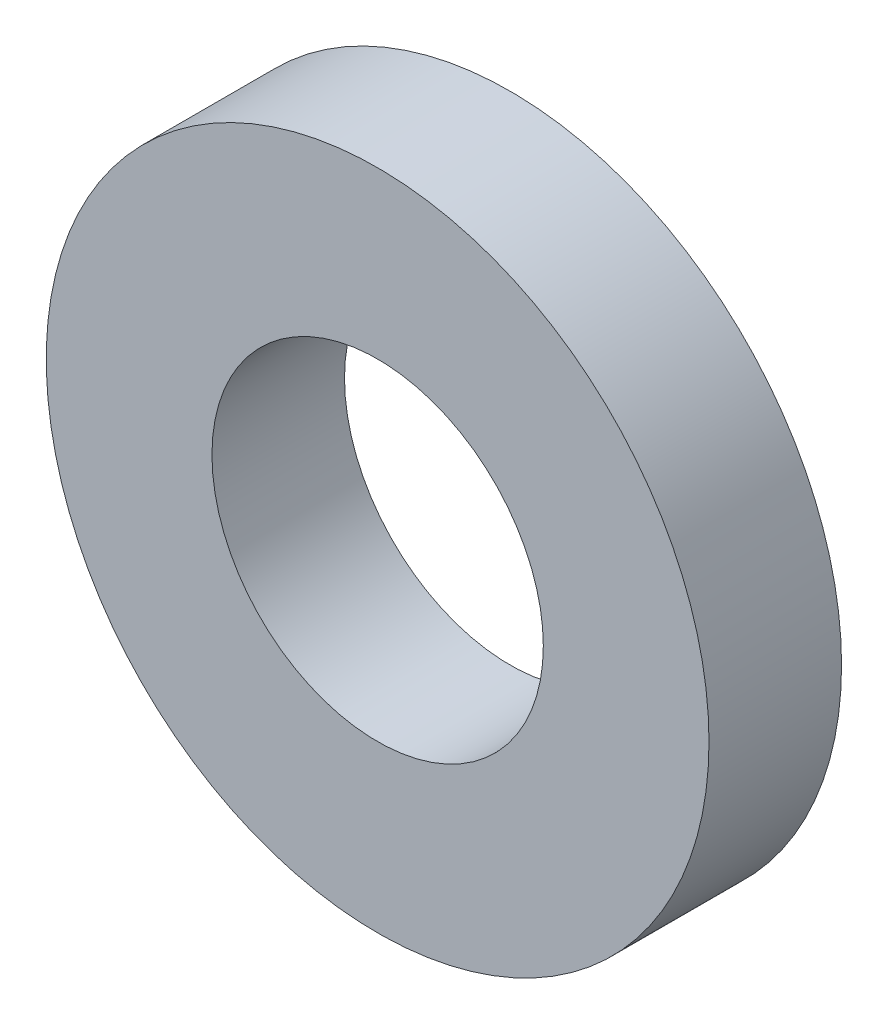
from build123d import *

# Parameters (mm, degrees)
SKETCH1_R           = 5
BOSS_EXTRUDE1_DEPTH = 2
SKETCH2_R           = 2.5
CUT_EXTRUDE1_DEPTH  = 8.348469228


with BuildPart() as part:
    # Sketch1 → Boss-Extrude1 (new body)
    with BuildSketch(Plane.XY):
        Circle(SKETCH1_R)
    extrude(amount=BOSS_EXTRUDE1_DEPTH)

    # Sketch2 → Cut-Extrude1 (cut, through all)
    with BuildSketch(Plane.XY.offset(2)):
        Circle(SKETCH2_R)
    extrude(amount=-CUT_EXTRUDE1_DEPTH, mode=Mode.SUBTRACT)


solid = part.part
